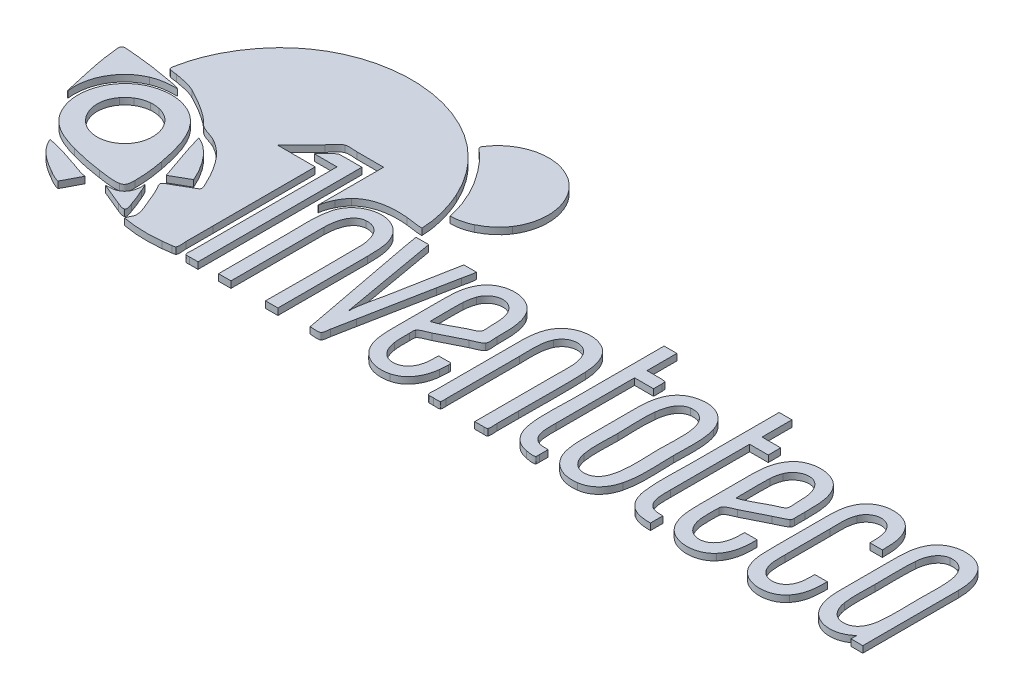
from build123d import *

# Parameters (mm, degrees)
SALIENTE_EXTRUIR1_DEPTH    = 0.3
SALIENTE_EXTRUIR1_2_DEPTH  = 0.3
SALIENTE_EXTRUIR1_3_DEPTH  = 0.3
SALIENTE_EXTRUIR1_4_DEPTH  = 0.3
SALIENTE_EXTRUIR1_5_DEPTH  = 0.3
SALIENTE_EXTRUIR1_6_DEPTH  = 0.3
SALIENTE_EXTRUIR1_7_DEPTH  = 0.3
SALIENTE_EXTRUIR1_8_DEPTH  = 0.3
SALIENTE_EXTRUIR1_9_DEPTH  = 0.3
SALIENTE_EXTRUIR1_10_DEPTH = 0.3
SALIENTE_EXTRUIR1_11_DEPTH = 0.3
SALIENTE_EXTRUIR1_12_DEPTH = 0.3
SALIENTE_EXTRUIR1_13_DEPTH = 0.3
SALIENTE_EXTRUIR1_14_DEPTH = 0.3
SALIENTE_EXTRUIR1_15_DEPTH = 0.3
SALIENTE_EXTRUIR1_16_DEPTH = 0.3
SALIENTE_EXTRUIR1_17_DEPTH = 0.3
SALIENTE_EXTRUIR1_18_DEPTH = 0.3


with BuildPart() as part:
    # Croquis1 → Saliente-Extruir1 (new body)
    with BuildSketch(Plane(origin=(0, 0, 0), x_dir=(1, 0, 0), z_dir=(0, 1, 0))):
        with BuildLine():
            Line((3.578406282, 3.929124777), (1.831381085, 3.929124777))
            add(Edge.make_bspline(
                [(1.831381085, 3.929124777), (2.195955538, 4.293699449), (2.561850832, 4.656953063), (2.925104228, 5.022805122)],
                knots=[0, 0, 0, 0, 1, 1, 1, 1], degree=3))
            add(Edge.make_bspline(
                [(2.925104228, 5.022805122), (3.050477873, 5.149089533), (3.225876383, 5.406839742), (3.393761239, 5.468737315)],
                knots=[0, 0, 0, 0, 1, 1, 1, 1], degree=3))
            add(Edge.make_bspline(
                [(3.393761239, 5.468737315), (3.539659104, 5.52252512), (3.778106582, 5.477296898), (3.933492482, 5.477296898)],
                knots=[0, 0, 0, 0, 1, 1, 1, 1], degree=3))
            Line((3.933492482, 5.477296898), (5.154989666, 5.477296898))
            Line((5.154989666, 5.477296898), (5.154989666, 2.480368276))
            Line((5.154989666, 2.480368276), (5.169193769, 2.480368276))
            add(Edge.make_bspline(
                [(5.169193769, 2.480368276), (5.184873963, 2.677469913), (5.263674964, 2.886373947), (5.350372835, 3.062709863)],
                knots=[0, 0, 0, 0, 1, 1, 1, 1], degree=3))
            add(Edge.make_bspline(
                [(5.350372835, 3.062709863), (5.429102652, 3.222826461), (5.527291326, 3.374887662), (5.652324117, 3.503017188)],
                knots=[0, 0, 0, 0, 1, 1, 1, 1], degree=3))
            add(Edge.make_bspline(
                [(5.652324117, 3.503017188), (6.163520725, 4.026898354), (6.976569044, 4.092033938), (7.66900171, 4.026131922)],
                knots=[0, 0, 0, 0, 1, 1, 1, 1], degree=3))
            add(Edge.make_bspline(
                [(7.66900171, 4.026131922), (7.927561368, 4.001529673), (8.175738383, 3.943324513), (8.435988121, 3.943324513)],
                knots=[0, 0, 0, 0, 1, 1, 1, 1], degree=3))
            add(Edge.make_bspline(
                [(8.435988121, 3.943324513), (8.421102745, 4.664846657), (8.194841973, 5.406920534), (7.900603268, 6.059638484)],
                knots=[0, 0, 0, 0, 1, 1, 1, 1], degree=3))
            add(Edge.make_bspline(
                [(7.900603268, 6.059638484), (7.603907177, 6.717756614), (7.184706429, 7.310922142), (6.674759913, 7.820867784)],
                knots=[0, 0, 0, 0, 1, 1, 1, 1], degree=3))
            add(Edge.make_bspline(
                [(6.674759913, 7.820867784), (4.340535784, 10.155095188), (0.329636401, 10.188178411), (-1.988793551, 7.792404989)],
                knots=[0, 0, 0, 0, 1, 1, 1, 1], degree=3))
            add(Edge.make_bspline(
                [(-1.988793551, 7.792404989), (-2.582355833, 7.179041248), (-3.048016117, 6.446839277), (-3.346856689, 5.647739365)],
                knots=[0, 0, 0, 0, 1, 1, 1, 1], degree=3))
            add(Edge.make_bspline(
                [(-3.346856689, 5.647739365), (-3.449590458, 5.373001005), (-3.543901117, 5.085311909), (-3.59318728, 4.79553314)],
                knots=[0, 0, 0, 0, 1, 1, 1, 1], degree=3))
            add(Edge.make_bspline(
                [(-3.59318728, 4.79553314), (-3.604421732, 4.72948679), (-3.66630664, 4.565535848), (-3.622290079, 4.507599266)],
                knots=[0, 0, 0, 0, 1, 1, 1, 1], degree=3))
            add(Edge.make_bspline(
                [(-3.622290079, 4.507599266), (-3.566200576, 4.433755617), (-3.326460645, 4.433897549), (-3.239251383, 4.417564468)],
                knots=[0, 0, 0, 0, 1, 1, 1, 1], degree=3))
            add(Edge.make_bspline(
                [(-3.239251383, 4.417564468), (-2.921363774, 4.357994578), (-2.57941566, 4.304986306), (-2.28761993, 4.159089096)],
                knots=[0, 0, 0, 0, 1, 1, 1, 1], degree=3))
            add(Edge.make_bspline(
                [(-2.28761993, 4.159089096), (-1.838094895, 3.934334767), (-1.38344219, 3.663913319), (-0.980902058, 3.362474084)],
                knots=[0, 0, 0, 0, 1, 1, 1, 1], degree=3))
            add(Edge.make_bspline(
                [(-0.980902058, 3.362474084), (-0.821809334, 3.243336705), (-0.708252716, 3.076018703), (-0.540594951, 2.969478104)],
                knots=[0, 0, 0, 0, 1, 1, 1, 1], degree=3))
            add(Edge.make_bspline(
                [(-0.540594951, 2.969478104), (-0.333579702, 2.837927147), (-0.07820172, 2.799577161), (0.141170772, 2.689898776)],
                knots=[0, 0, 0, 0, 1, 1, 1, 1], degree=3))
            add(Edge.make_bspline(
                [(0.141170772, 2.689898776), (0.511298691, 2.504826409), (0.835989639, 2.197777591), (1.084322779, 1.869620448)],
                knots=[0, 0, 0, 0, 1, 1, 1, 1], degree=3))
            add(Edge.make_bspline(
                [(1.084322779, 1.869620448), (1.33001424, 1.544943912), (1.540693951, 1.189459429), (1.707897098, 0.81856333)],
                knots=[0, 0, 0, 0, 1, 1, 1, 1], degree=3))
            add(Edge.make_bspline(
                [(1.707897098, 0.81856333), (1.743135938, 0.740374165), (1.885795355, 0.518871167), (1.824251739, 0.44045491)],
                knots=[0, 0, 0, 0, 1, 1, 1, 1], degree=3))
            add(Edge.make_bspline(
                [(1.824251739, 0.44045491), (1.764753469, 0.3646502), (1.629991141, 0.314227271), (1.54731278, 0.266761111)],
                knots=[0, 0, 0, 0, 1, 1, 1, 1], degree=3))
            add(Edge.make_bspline(
                [(1.54731278, 0.266761111), (1.356759223, 0.157364406), (1.168165855, 0.044375734), (0.979174641, -0.06768929)],
                knots=[0, 0, 0, 0, 1, 1, 1, 1], degree=3))
            add(Edge.make_bspline(
                [(0.979174641, -0.06768929), (0.905629267, -0.111292938), (0.712476174, -0.17778015), (0.702647503, -0.275315719)],
                knots=[0, 0, 0, 0, 1, 1, 1, 1], degree=3))
            add(Edge.make_bspline(
                [(0.702647503, -0.275315719), (0.693756018, -0.363531824), (0.792825324, -0.48487264), (0.832751191, -0.559170471)],
                knots=[0, 0, 0, 0, 1, 1, 1, 1], degree=3))
            add(Edge.make_bspline(
                [(0.832751191, -0.559170471), (0.941933251, -0.762395048), (1.029199287, -0.984238683), (1.114831795, -1.198326505)],
                knots=[0, 0, 0, 0, 1, 1, 1, 1], degree=3))
            add(Edge.make_bspline(
                [(1.114831795, -1.198326505), (1.212949285, -1.443619465), (1.394554802, -1.782002251), (1.387396196, -2.050532731)],
                knots=[0, 0, 0, 0, 1, 1, 1, 1], degree=3))
            add(Edge.make_bspline(
                [(1.387396196, -2.050532731), (1.383277989, -2.204755882), (1.259564946, -2.307446852), (1.249039498, -2.448225563)],
                knots=[0, 0, 0, 0, 1, 1, 1, 1], degree=3))
            add(Edge.make_bspline(
                [(1.249039498, -2.448225563), (1.825884173, -2.555320788), (2.428281167, -2.569708311), (3.010267706, -2.507398044)],
                knots=[0, 0, 0, 0, 1, 1, 1, 1], degree=3))
            add(Edge.make_bspline(
                [(3.010267706, -2.507398044), (3.148538372, -2.49259346), (3.284877454, -2.477129439), (3.422167917, -2.454105909)],
                knots=[0, 0, 0, 0, 1, 1, 1, 1], degree=3))
            add(Edge.make_bspline(
                [(3.422167917, -2.454105909), (3.463372044, -2.447184002), (3.535980231, -2.44794825), (3.563804769, -2.411454295)],
                knots=[0, 0, 0, 0, 1, 1, 1, 1], degree=3))
            add(Edge.make_bspline(
                [(3.563804769, -2.411454295), (3.6257744, -2.330182151), (3.578406282, -2.066466219), (3.578406282, -1.965308331)],
                knots=[0, 0, 0, 0, 1, 1, 1, 1], degree=3))
            add(Edge.make_bspline(
                [(3.578406282, -1.965308331), (3.578406282, -1.558223977), (3.582638034, -1.150556611), (3.578463054, -0.74381071)],
                knots=[0, 0, 0, 0, 1, 1, 1, 1], degree=3))
            add(Edge.make_bspline(
                [(3.578463054, -0.74381071), (3.562442224, 0.813455967), (3.578406282, 2.371759839), (3.578406282, 3.929124777)],
                knots=[0, 0, 0, 0, 1, 1, 1, 1], degree=3))
        make_face()
    extrude(amount=SALIENTE_EXTRUIR1_DEPTH)


with BuildPart() as body_2:
    # Croquis1 → Saliente-Extruir1 2 (new body)
    with BuildSketch(Plane(origin=(0, 0, 0), x_dir=(1, 0, 0), z_dir=(0, 1, 0))):
        with BuildLine():
            Line((3.038675476, 4.426241963), (4.075527835, 4.426241963))
            Line((4.075527835, 4.426241963), (4.075527835, -0.829037512))
            Line((4.075527835, -0.829037512), (4.075527835, -2.078940937))
            add(Edge.make_bspline(
                [(4.075527835, -2.078940937), (4.075527835, -2.159346423), (4.032391907, -2.438244478), (4.098295888, -2.490442647)],
                knots=[0, 0, 0, 0, 1, 1, 1, 1], degree=3))
            add(Edge.make_bspline(
                [(4.098295888, -2.490442647), (4.135480505, -2.519901148), (4.215829437, -2.50505071), (4.260172659, -2.50505071)],
                knots=[0, 0, 0, 0, 1, 1, 1, 1], degree=3))
            Line((4.260172659, -2.50505071), (4.657869422, -2.50505071))
            Line((4.657869422, -2.50505071), (4.657869422, 4.980170977))
            Line((4.657869422, 4.980170977), (3.919289689, 4.980170977))
            Line((3.919289689, 4.980170977), (3.592610385, 4.971611394))
            Line((3.592610385, 4.971611394), (3.407965342, 4.809735059))
            Line((3.407965342, 4.809735059), (3.038675476, 4.426241963))
        make_face()
    extrude(amount=SALIENTE_EXTRUIR1_2_DEPTH)


with BuildPart() as body_3:
    # Croquis1 → Saliente-Extruir1 3 (new body)
    with BuildSketch(Plane(origin=(0, 0, 0), x_dir=(1, 0, 0), z_dir=(0, 1, 0))):
        with BuildLine():
            Line((18.63406794, 4.809735059), (18.63406794, 0.733343079))
            add(Edge.make_bspline(
                [(18.63406794, 0.733343079), (18.63406794, 0.008298841), (18.545581291, -0.783842043), (18.690882169, -1.49659935)],
                knots=[0, 0, 0, 0, 1, 1, 1, 1], degree=3))
            add(Edge.make_bspline(
                [(18.690882169, -1.49659935), (18.793005412, -1.996943849), (19.118832688, -2.395706629), (19.642512967, -2.474734066)],
                knots=[0, 0, 0, 0, 1, 1, 1, 1], degree=3))
            add(Edge.make_bspline(
                [(19.642512967, -2.474734066), (19.723756943, -2.486983876), (20.010524574, -2.555111166), (20.068190393, -2.482267372)],
                knots=[0, 0, 0, 0, 1, 1, 1, 1], degree=3))
            add(Edge.make_bspline(
                [(20.068190393, -2.482267372), (20.095744825, -2.44748315), (20.082820292, -2.375925696), (20.082820292, -2.33459514)],
                knots=[0, 0, 0, 0, 1, 1, 1, 1], degree=3))
            Line((20.082820292, -2.33459514), (20.082820292, -1.936897941))
            add(Edge.make_bspline(
                [(20.082820292, -1.936897941), (19.934820307, -1.936897941), (19.784263365, -1.944016369), (19.642512967, -1.893008245)],
                knots=[0, 0, 0, 0, 1, 1, 1, 1], degree=3))
            add(Edge.make_bspline(
                [(19.642512967, -1.893008245), (19.174367347, -1.724498016), (19.216409745, -1.115468873), (19.216409745, -0.71540032)],
                knots=[0, 0, 0, 0, 1, 1, 1, 1], degree=3))
            Line((19.216409745, -0.71540032), (19.216409745, 2.878074209))
            Line((19.216409745, 2.878074209), (20.082820292, 2.878074209))
            Line((20.082820292, 2.878074209), (20.082820292, 3.275771409))
            Line((20.082820292, 3.275771409), (20.068190393, 3.42344364))
            Line((20.068190393, 3.42344364), (19.855565561, 3.446211693))
            Line((19.855565561, 3.446211693), (19.216409745, 3.446211693))
            Line((19.216409745, 3.446211693), (19.216409745, 4.809743794))
            Line((19.216409745, 4.809743794), (18.63406794, 4.809735059))
        make_face()
    extrude(amount=SALIENTE_EXTRUIR1_3_DEPTH)


with BuildPart() as body_4:
    # Croquis1 → Saliente-Extruir1 4 (new body)
    with BuildSketch(Plane(origin=(0, 0, 0), x_dir=(1, 0, 0), z_dir=(0, 1, 0))):
        with BuildLine():
            Line((23.889347415, 4.809743794), (23.889347415, 0.804370145))
            add(Edge.make_bspline(
                [(23.889347415, 0.804370145), (23.889347415, 0.086455253), (23.82088604, -0.67162417), (23.921871645, -1.382962158)],
                knots=[0, 0, 0, 0, 1, 1, 1, 1], degree=3))
            add(Edge.make_bspline(
                [(23.921871645, -1.382962158), (23.977408269, -1.775148035), (24.15892819, -2.172987166), (24.528501047, -2.357745317)],
                knots=[0, 0, 0, 0, 1, 1, 1, 1], degree=3))
            add(Edge.make_bspline(
                [(24.528501047, -2.357745317), (24.773512327, -2.480265041), (25.054172739, -2.505035425), (25.323895446, -2.505035425)],
                knots=[0, 0, 0, 0, 1, 1, 1, 1], degree=3))
            Line((25.323895446, -2.505035425), (25.323895446, -1.936897941))
            add(Edge.make_bspline(
                [(25.323895446, -1.936897941), (25.180439464, -1.936897941), (25.035138586, -1.942444201), (24.897792224, -1.893008245)],
                knots=[0, 0, 0, 0, 1, 1, 1, 1], degree=3))
            add(Edge.make_bspline(
                [(24.897792224, -1.893008245), (24.430356263, -1.724753493), (24.471689002, -1.129629305), (24.471689002, -0.729604423)],
                knots=[0, 0, 0, 0, 1, 1, 1, 1], degree=3))
            Line((24.471689002, -0.729604423), (24.471689002, 2.878074209))
            Line((24.471689002, 2.878074209), (25.323895446, 2.878074209))
            Line((25.323895446, 2.878074209), (25.323895446, 3.446211693))
            Line((25.323895446, 3.446211693), (24.471689002, 3.446211693))
            Line((24.471689002, 3.446211693), (24.471689002, 4.809743794))
            Line((24.471689002, 4.809743794), (23.889347415, 4.809743794))
        make_face()
    extrude(amount=SALIENTE_EXTRUIR1_4_DEPTH)


with BuildPart() as body_5:
    # Croquis1 → Saliente-Extruir1 5 (new body)
    with BuildSketch(Plane(origin=(0, 0, 0), x_dir=(1, 0, 0), z_dir=(0, 1, 0))):
        with BuildLine():
            Line((-5.099902854, 1.301487332), (-5.085700498, 1.301487332))
            add(Edge.make_bspline(
                [(-5.085700498, 1.301487332), (-5.211824417, 2.29946412), (-4.694224936, 3.292242054), (-3.750575948, 3.695806498)],
                knots=[0, 0, 0, 0, 1, 1, 1, 1], degree=3))
            add(Edge.make_bspline(
                [(-3.750575948, 3.695806498), (-3.393032361, 3.848706189), (-3.039678822, 3.872312731), (-2.656910015, 3.872312731)],
                knots=[0, 0, 0, 0, 1, 1, 1, 1], degree=3))
            add(Edge.make_bspline(
                [(-2.656910015, 3.872312731), (-2.840816138, 3.970813437), (-3.106577199, 3.987814689), (-3.310268841, 4.028549131)],
                knots=[0, 0, 0, 0, 1, 1, 1, 1], degree=3))
            add(Edge.make_bspline(
                [(-3.310268841, 4.028549131), (-3.835541159, 4.133585034), (-4.368431941, 4.201845521), (-4.901055892, 4.253390803)],
                knots=[0, 0, 0, 0, 1, 1, 1, 1], degree=3))
            add(Edge.make_bspline(
                [(-4.901055892, 4.253390803), (-5.071193097, 4.269854897), (-5.242778007, 4.274418552), (-5.412380238, 4.29436762)],
                knots=[0, 0, 0, 0, 1, 1, 1, 1], degree=3))
            add(Edge.make_bspline(
                [(-5.412380238, 4.29436762), (-5.478458687, 4.302141119), (-5.569636801, 4.304346521), (-5.608685965, 4.238562199)],
                knots=[0, 0, 0, 0, 1, 1, 1, 1], degree=3))
            add(Edge.make_bspline(
                [(-5.608685965, 4.238562199), (-5.647504108, 4.173168736), (-5.621132297, 4.070648302), (-5.613583706, 4.000143108)],
                knots=[0, 0, 0, 0, 1, 1, 1, 1], degree=3))
            add(Edge.make_bspline(
                [(-5.613583706, 4.000143108), (-5.593783121, 3.815199354), (-5.573445815, 3.630312591), (-5.546194026, 3.446207326)],
                knots=[0, 0, 0, 0, 1, 1, 1, 1], degree=3))
            add(Edge.make_bspline(
                [(-5.546194026, 3.446207326), (-5.438327346, 2.717470676), (-5.248563586, 2.019812734), (-5.099902854, 1.301487332)],
                knots=[0, 0, 0, 0, 1, 1, 1, 1], degree=3))
        make_face()
    extrude(amount=SALIENTE_EXTRUIR1_5_DEPTH)


with BuildPart() as body_6:
    # Croquis1 → Saliente-Extruir1 6 (new body)
    with BuildSketch(Plane(origin=(0, 0, 0), x_dir=(1, 0, 0), z_dir=(0, 1, 0))):
        with BuildLine():
            Line((5.595298301, -2.505039792), (6.16343644, -2.505039792))
            add(Edge.make_bspline(
                [(6.16343644, -2.505039792), (6.16343644, -1.089766107), (6.146662278, 0.326632115), (6.163493212, 1.741792473)],
                knots=[0, 0, 0, 0, 1, 1, 1, 1], degree=3))
            add(Edge.make_bspline(
                [(6.163493212, 1.741792473), (6.16898925, 2.204612155), (6.291054574, 2.919302137), (6.873609058, 2.962012489)],
                knots=[0, 0, 0, 0, 1, 1, 1, 1], degree=3))
            add(Edge.make_bspline(
                [(6.873609058, 2.962012489), (7.500237313, 3.007946003), (7.726938511, 2.380834743), (7.739806707, 1.855420712)],
                knots=[0, 0, 0, 0, 1, 1, 1, 1], degree=3))
            add(Edge.make_bspline(
                [(7.739806707, 1.855420712), (7.775372209, 0.403899816), (7.740019824, -1.053034143), (7.740019824, -2.505039792)],
                knots=[0, 0, 0, 0, 1, 1, 1, 1], degree=3))
            Line((7.740019824, -2.505039792), (8.308157962, -2.505039792))
            Line((8.308157962, -2.505039792), (8.308157962, 1.585556074))
            add(Edge.make_bspline(
                [(8.308157962, 1.585556074), (8.308157962, 2.198775481), (8.285290557, 2.929117271), (7.725816376, 3.317822541)],
                knots=[0, 0, 0, 0, 1, 1, 1, 1], degree=3))
            add(Edge.make_bspline(
                [(7.725816376, 3.317822541), (6.987364599, 3.830866447), (5.919236355, 3.435754591), (5.693074717, 2.579796779)],
                knots=[0, 0, 0, 0, 1, 1, 1, 1], degree=3))
            add(Edge.make_bspline(
                [(5.693074717, 2.579796779), (5.531340096, 1.967656054), (5.595298301, 1.304312867), (5.595298301, 0.676533217)],
                knots=[0, 0, 0, 0, 1, 1, 1, 1], degree=3))
            Line((5.595298301, 0.676533217), (5.595298301, -2.505039792))
        make_face()
    extrude(amount=SALIENTE_EXTRUIR1_6_DEPTH)


with BuildPart() as body_7:
    # Croquis1 → Saliente-Extruir1 7 (new body)
    with BuildSketch(Plane(origin=(0, 0, 0), x_dir=(1, 0, 0), z_dir=(0, 1, 0))):
        with BuildLine():
            Line((12.824857486, 0.026684474), (13.946930752, 0.587804192))
            add(Edge.make_bspline(
                [(13.946930752, 0.587804192), (14.084702691, 0.656719531), (14.333548533, 0.726146042), (14.435529626, 0.841820502)],
                knots=[0, 0, 0, 0, 1, 1, 1, 1], degree=3))
            add(Edge.make_bspline(
                [(14.435529626, 0.841820502), (14.511517756, 0.92800589), (14.458254007, 1.23161974), (14.458254007, 1.344097457)],
                knots=[0, 0, 0, 0, 1, 1, 1, 1], degree=3))
            add(Edge.make_bspline(
                [(14.458254007, 1.344097457), (14.458254007, 1.85390095), (14.475875392, 2.394938402), (14.24136707, 2.863865739)],
                knots=[0, 0, 0, 0, 1, 1, 1, 1], degree=3))
            add(Edge.make_bspline(
                [(14.24136707, 2.863865739), (13.81668535, 3.713218043), (12.481275627, 3.769278941), (11.993244699, 2.949087956)],
                knots=[0, 0, 0, 0, 1, 1, 1, 1], degree=3))
            add(Edge.make_bspline(
                [(11.993244699, 2.949087956), (11.716845518, 2.484464647), (11.731191116, 1.922006403), (11.731191116, 1.400909503)],
                knots=[0, 0, 0, 0, 1, 1, 1, 1], degree=3))
            Line((11.731191116, 1.400909503), (11.731191116, -0.317707488))
            add(Edge.make_bspline(
                [(11.731191116, -0.317707488), (11.731191116, -0.761381873), (11.713720397, -1.207525873), (11.836722689, -1.638629463)],
                knots=[0, 0, 0, 0, 1, 1, 1, 1], degree=3))
            add(Edge.make_bspline(
                [(11.836722689, -1.638629463), (12.044377286, -2.366612783), (12.738927575, -2.726073541), (13.464013302, -2.549099806)],
                knots=[0, 0, 0, 0, 1, 1, 1, 1], degree=3))
            add(Edge.make_bspline(
                [(13.464013302, -2.549099806), (14.070642704, -2.40101488), (14.362950262, -1.832578029), (14.432121078, -1.255136367)],
                knots=[0, 0, 0, 0, 1, 1, 1, 1], degree=3))
            add(Edge.make_bspline(
                [(14.432121078, -1.255136367), (14.44718769, -1.128341001), (14.458254007, -0.999445043), (14.458254007, -0.871643271)],
                knots=[0, 0, 0, 0, 1, 1, 1, 1], degree=3))
            add(Edge.make_bspline(
                [(14.458254007, -0.871643271), (14.458254007, -0.83447241), (14.468909814, -0.770670767), (14.435529626, -0.744208119)],
                knots=[0, 0, 0, 0, 1, 1, 1, 1], degree=3))
            add(Edge.make_bspline(
                [(14.435529626, -0.744208119), (14.398315312, -0.714751801), (14.317925111, -0.729600056), (14.27360962, -0.729600056)],
                knots=[0, 0, 0, 0, 1, 1, 1, 1], degree=3))
            Line((14.27360962, -0.729600056), (13.87591242, -0.729608791))
            add(Edge.make_bspline(
                [(13.87591242, -0.729608791), (13.87591242, -1.065532881), (13.873641511, -1.416089053), (13.683457196, -1.709645393)],
                knots=[0, 0, 0, 0, 1, 1, 1, 1], degree=3))
            add(Edge.make_bspline(
                [(13.683457196, -1.709645393), (13.441712532, -2.082814585), (12.907804426, -2.152679993), (12.598880141, -1.823217078)],
                knots=[0, 0, 0, 0, 1, 1, 1, 1], degree=3))
            add(Edge.make_bspline(
                [(12.598880141, -1.823217078), (12.443637483, -1.657619727), (12.374322333, -1.432210328), (12.338387372, -1.212526241)],
                knots=[0, 0, 0, 0, 1, 1, 1, 1], degree=3))
            add(Edge.make_bspline(
                [(12.338387372, -1.212526241), (12.300181501, -0.978480617), (12.313531829, -0.738755753), (12.313531829, -0.502351876)],
                knots=[0, 0, 0, 0, 1, 1, 1, 1], degree=3))
            add(Edge.make_bspline(
                [(12.313531829, -0.502351876), (12.313531829, -0.431023696), (12.288534355, -0.300110122), (12.328161728, -0.238026946)],
                knots=[0, 0, 0, 0, 1, 1, 1, 1], degree=3))
            add(Edge.make_bspline(
                [(12.328161728, -0.238026946), (12.403724063, -0.119511666), (12.699725998, -0.03591184), (12.824857486, 0.026684474)],
                knots=[0, 0, 0, 0, 1, 1, 1, 1], degree=3))
        make_face()
        with BuildLine():
            add(Edge.make_bspline(
                [(12.313529646, 0.435074601), (12.313529646, 0.940078832), (12.291934168, 1.450367076), (12.314184716, 1.954845067)],
                knots=[0, 0, 0, 0, 1, 1, 1, 1], degree=3))
            add(Edge.make_bspline(
                [(12.314184716, 1.954845067), (12.321718022, 2.127801038), (12.3607733, 2.30332685), (12.417871393, 2.466170723)],
                knots=[0, 0, 0, 0, 1, 1, 1, 1], degree=3))
            add(Edge.make_bspline(
                [(12.417871393, 2.466170723), (12.593851387, 2.967637357), (13.24848891, 3.155605352), (13.617780087, 2.736035362)],
                knots=[0, 0, 0, 0, 1, 1, 1, 1], degree=3))
            add(Edge.make_bspline(
                [(13.617780087, 2.736035362), (13.862363387, 2.458102444), (13.875997579, 2.03466754), (13.875997579, 1.684980428)],
                knots=[0, 0, 0, 0, 1, 1, 1, 1], degree=3))
            add(Edge.make_bspline(
                [(13.875997579, 1.684980428), (13.875997579, 1.573354301), (13.925710848, 1.303332446), (13.861367681, 1.211109495)],
                knots=[0, 0, 0, 0, 1, 1, 1, 1], degree=3))
            add(Edge.make_bspline(
                [(13.861367681, 1.211109495), (13.79219883, 1.111984289), (13.557415378, 1.046306962), (13.449894358, 0.992519376)],
                knots=[0, 0, 0, 0, 1, 1, 1, 1], degree=3))
            add(Edge.make_bspline(
                [(13.449894358, 0.992519376), (13.088699847, 0.81192092), (12.701230475, 0.546742216), (12.313529646, 0.435074601)],
                knots=[0, 0, 0, 0, 1, 1, 1, 1], degree=3))
        make_face(mode=Mode.SUBTRACT)
    extrude(amount=SALIENTE_EXTRUIR1_7_DEPTH)


with BuildPart() as body_8:
    # Croquis1 → Saliente-Extruir1 8 (new body)
    with BuildSketch(Plane(origin=(0, 0, 0), x_dir=(1, 0, 0), z_dir=(0, 1, 0))):
        with BuildLine():
            Line((17.298946448, -2.505031057), (17.725049669, -2.505031057))
            add(Edge.make_bspline(
                [(17.725049669, -2.505031057), (17.768227523, -2.505031057), (17.849329567, -2.519748299), (17.872765572, -2.472107235)],
                knots=[0, 0, 0, 0, 1, 1, 1, 1], degree=3))
            add(Edge.make_bspline(
                [(17.872765572, -2.472107235), (17.91906811, -2.377853785), (17.881281484, -2.183507592), (17.881281484, -2.078927836)],
                knots=[0, 0, 0, 0, 1, 1, 1, 1], degree=3))
            Line((17.881281484, -2.078927836), (17.881281484, -1.098889049))
            add(Edge.make_bspline(
                [(17.881281484, -1.098889049), (17.881281484, -0.073244284), (17.912528327, 0.959377196), (17.86763419, 1.983259824)],
                knots=[0, 0, 0, 0, 1, 1, 1, 1], degree=3))
            add(Edge.make_bspline(
                [(17.86763419, 1.983259824), (17.846038931, 2.477158432), (17.716793603, 3.045125598), (17.270520773, 3.331310216)],
                knots=[0, 0, 0, 0, 1, 1, 1, 1], degree=3))
            add(Edge.make_bspline(
                [(17.270520773, 3.331310216), (16.580090438, 3.774089339), (15.593376269, 3.492946577), (15.3023485, 2.721839993)],
                knots=[0, 0, 0, 0, 1, 1, 1, 1], degree=3))
            add(Edge.make_bspline(
                [(15.3023485, 2.721839993), (15.128355552, 2.261109767), (15.154206801, 1.756686583), (15.154206801, 1.27308786)],
                knots=[0, 0, 0, 0, 1, 1, 1, 1], degree=3))
            Line((15.154206801, 1.27308786), (15.154206801, -0.786412101))
            Line((15.154206801, -0.786412101), (15.154206801, -2.064723732))
            add(Edge.make_bspline(
                [(15.154206801, -2.064723732), (15.154206801, -2.147118448), (15.109749378, -2.43716798), (15.176931182, -2.490429545)],
                knots=[0, 0, 0, 0, 1, 1, 1, 1], degree=3))
            add(Edge.make_bspline(
                [(15.176931182, -2.490429545), (15.227353892, -2.530299294), (15.362713208, -2.505037608), (15.42407144, -2.505037608)],
                knots=[0, 0, 0, 0, 1, 1, 1, 1], degree=3))
            add(Edge.make_bspline(
                [(15.42407144, -2.505037608), (15.49366827, -2.505037608), (15.657293641, -2.535205769), (15.713821823, -2.490429545)],
                knots=[0, 0, 0, 0, 1, 1, 1, 1], degree=3))
            add(Edge.make_bspline(
                [(15.713821823, -2.490429545), (15.762541569, -2.451824081), (15.736548388, -2.305302589), (15.736548388, -2.249368338)],
                knots=[0, 0, 0, 0, 1, 1, 1, 1], degree=3))
            Line((15.736548388, -2.249368338), (15.736548388, -1.524992271))
            Line((15.736548388, -1.524992271), (15.736548388, 1.102647357))
            add(Edge.make_bspline(
                [(15.736548388, 1.102647357), (15.736548388, 1.566063371), (15.671637493, 2.0888069), (15.868783019, 2.522991503)],
                knots=[0, 0, 0, 0, 1, 1, 1, 1], degree=3))
            add(Edge.make_bspline(
                [(15.868783019, 2.522991503), (16.106263177, 3.045907315), (16.803368676, 3.121753513), (17.113288667, 2.622415639)],
                knots=[0, 0, 0, 0, 1, 1, 1, 1], degree=3))
            add(Edge.make_bspline(
                [(17.113288667, 2.622415639), (17.372360152, 2.205118743), (17.298928979, 1.641156239), (17.298928979, 1.173663505)],
                knots=[0, 0, 0, 0, 1, 1, 1, 1], degree=3))
            Line((17.298928979, 1.173663505), (17.298928979, -0.303494652))
            Line((17.298928979, -0.303494652), (17.298946448, -2.505031057))
        make_face()
    extrude(amount=SALIENTE_EXTRUIR1_8_DEPTH)


with BuildPart() as body_9:
    # Croquis1 → Saliente-Extruir1 9 (new body)
    with BuildSketch(Plane(origin=(0, 0, 0), x_dir=(1, 0, 0), z_dir=(0, 1, 0))):
        with BuildLine():
            Line((20.452096184, 1.244681837), (20.452096184, -0.331902857))
            add(Edge.make_bspline(
                [(20.452096184, -0.331902857), (20.452096184, -0.752311336), (20.43860174, -1.171141097), (20.542569879, -1.5818065)],
                knots=[0, 0, 0, 0, 1, 1, 1, 1], degree=3))
            add(Edge.make_bspline(
                [(20.542569879, -1.5818065), (20.726646757, -2.30814341), (21.344355578, -2.675102537), (22.071288602, -2.571985771)],
                knots=[0, 0, 0, 0, 1, 1, 1, 1], degree=3))
            add(Edge.make_bspline(
                [(22.071288602, -2.571985771), (22.63204148, -2.492460262), (22.974201838, -2.048517298), (23.102885989, -1.524992271)],
                knots=[0, 0, 0, 0, 1, 1, 1, 1], degree=3))
            add(Edge.make_bspline(
                [(23.102885989, -1.524992271), (23.27588323, -0.820316346), (23.179157983, -0.01610252), (23.179157983, 0.704950158)],
                knots=[0, 0, 0, 0, 1, 1, 1, 1], degree=3))
            add(Edge.make_bspline(
                [(23.179157983, 0.704950158), (23.179157983, 1.338538096), (23.257135125, 2.040159211), (23.056013541, 2.650823845)],
                knots=[0, 0, 0, 0, 1, 1, 1, 1], degree=3))
            add(Edge.make_bspline(
                [(23.056013541, 2.650823845), (22.860147584, 3.245266978), (22.301242222, 3.608832842), (21.673591402, 3.525416217)],
                knots=[0, 0, 0, 0, 1, 1, 1, 1], degree=3))
            add(Edge.make_bspline(
                [(21.673591402, 3.525416217), (21.175618476, 3.459212651), (20.793263018, 3.220153775), (20.605633476, 2.736044096)],
                knots=[0, 0, 0, 0, 1, 1, 1, 1], degree=3))
            add(Edge.make_bspline(
                [(20.605633476, 2.736044096), (20.422410591, 2.262898108), (20.452096184, 1.742440992), (20.452096184, 1.244681837)],
                knots=[0, 0, 0, 0, 1, 1, 1, 1], degree=3))
        make_face()
        with BuildLine():
            add(Edge.make_bspline(
                [(21.702102236, 2.959184769), (22.193542149, 3.023187301), (22.478178618, 2.654577397), (22.561979551, 2.210507786)],
                knots=[0, 0, 0, 0, 1, 1, 1, 1], degree=3))
            add(Edge.make_bspline(
                [(22.561979551, 2.210507786), (22.659840471, 1.691328057), (22.596918806, 1.118290431), (22.596918806, 0.591313184)],
                knots=[0, 0, 0, 0, 1, 1, 1, 1], degree=3))
            add(Edge.make_bspline(
                [(22.596918806, 0.591313184), (22.596918806, 0.055503191), (22.660833994, -0.525419077), (22.590957668, -1.056287658)],
                knots=[0, 0, 0, 0, 1, 1, 1, 1], degree=3))
            add(Edge.make_bspline(
                [(22.590957668, -1.056287658), (22.535706873, -1.475899135), (22.411143331, -1.967764843), (21.915157232, -2.032221338)],
                knots=[0, 0, 0, 0, 1, 1, 1, 1], degree=3))
            add(Edge.make_bspline(
                [(21.915157232, -2.032221338), (21.432239781, -2.094972686), (21.150869928, -1.71544058), (21.06948402, -1.283542171)],
                knots=[0, 0, 0, 0, 1, 1, 1, 1], degree=3))
            add(Edge.make_bspline(
                [(21.06948402, -1.283542171), (20.974035941, -0.777559921), (21.034542582, -0.220484169), (21.034542582, 0.293040121)],
                knots=[0, 0, 0, 0, 1, 1, 1, 1], degree=3))
            add(Edge.make_bspline(
                [(21.034542582, 0.293040121), (21.034542582, 0.849362542), (20.97318435, 1.44532522), (21.038669523, 1.997455192)],
                knots=[0, 0, 0, 0, 1, 1, 1, 1], degree=3))
            add(Edge.make_bspline(
                [(21.038669523, 1.997455192), (21.086819358, 2.404428184), (21.22416572, 2.896918392), (21.702102236, 2.959184769)],
                knots=[0, 0, 0, 0, 1, 1, 1, 1], degree=3))
        make_face(mode=Mode.SUBTRACT)
    extrude(amount=SALIENTE_EXTRUIR1_9_DEPTH)


with BuildPart() as body_10:
    # Croquis1 → Saliente-Extruir1 10 (new body)
    with BuildSketch(Plane(origin=(0, 0, 0), x_dir=(1, 0, 0), z_dir=(0, 1, 0))):
        with BuildLine():
            Line((28.420233137, -0.729600056), (27.852095435, -0.729600056))
            add(Edge.make_bspline(
                [(27.852095435, -0.729600056), (27.852095435, -1.064928033), (27.846702025, -1.417615366), (27.657507084, -1.709636659)],
                knots=[0, 0, 0, 0, 1, 1, 1, 1], degree=3))
            add(Edge.make_bspline(
                [(27.657507084, -1.709636659), (27.395027268, -2.115033115), (26.823197155, -2.146352016), (26.524356582, -1.766450888)],
                knots=[0, 0, 0, 0, 1, 1, 1, 1], degree=3))
            add(Edge.make_bspline(
                [(26.524356582, -1.766450888), (26.218412867, -1.377546912), (26.28659016, -0.793698664), (26.289714844, -0.331902857)],
                knots=[0, 0, 0, 0, 1, 1, 1, 1], degree=3))
            add(Edge.make_bspline(
                [(26.289714844, -0.331902857), (26.291024984, -0.143052701), (26.637414911, -0.055007133), (26.786836398, 0.019675225)],
                knots=[0, 0, 0, 0, 1, 1, 1, 1], degree=3))
            Line((26.786836398, 0.019675225), (27.837891332, 0.545202801))
            add(Edge.make_bspline(
                [(27.837891332, 0.545202801), (28.013445748, 0.633008395), (28.211726512, 0.707563887), (28.37549185, 0.815678838)],
                knots=[0, 0, 0, 0, 1, 1, 1, 1], degree=3))
            add(Edge.make_bspline(
                [(28.37549185, 0.815678838), (28.43443724, 0.854596552), (28.420233137, 0.926750339), (28.420233137, 0.989019118)],
                knots=[0, 0, 0, 0, 1, 1, 1, 1], degree=3))
            Line((28.420233137, 0.989019118), (28.420233137, 1.457732247))
            add(Edge.make_bspline(
                [(28.420233137, 1.457732247), (28.420233137, 2.103777435), (28.433159853, 2.894269726), (27.837891332, 3.312136533)],
                knots=[0, 0, 0, 0, 1, 1, 1, 1], degree=3))
            add(Edge.make_bspline(
                [(27.837891332, 3.312136533), (27.405538741, 3.615649939), (26.700336576, 3.615280916), (26.275510741, 3.2968734)],
                knots=[0, 0, 0, 0, 1, 1, 1, 1], degree=3))
            add(Edge.make_bspline(
                [(26.275510741, 3.2968734), (26.063453854, 3.13789444), (25.926533288, 2.911760097), (25.838328319, 2.66501703)],
                knots=[0, 0, 0, 0, 1, 1, 1, 1], degree=3))
            add(Edge.make_bspline(
                [(25.838328319, 2.66501703), (25.682091919, 2.227893346), (25.707373257, 1.757843874), (25.707373257, 1.301487332)],
                knots=[0, 0, 0, 0, 1, 1, 1, 1], degree=3))
            Line((25.707373257, 1.301487332), (25.707373257, -0.644386356))
            add(Edge.make_bspline(
                [(25.707373257, -0.644386356), (25.707373257, -1.133994255), (25.726828839, -1.65746251), (26.010760016, -2.07893657)],
                knots=[0, 0, 0, 0, 1, 1, 1, 1], degree=3))
            add(Edge.make_bspline(
                [(26.010760016, -2.07893657), (26.442544879, -2.71989623), (27.526126227, -2.77463607), (28.032621834, -2.192562844)],
                knots=[0, 0, 0, 0, 1, 1, 1, 1], degree=3))
            add(Edge.make_bspline(
                [(28.032621834, -2.192562844), (28.385719678, -1.786786447), (28.430742645, -1.240733559), (28.420233137, -0.729600056)],
                knots=[0, 0, 0, 0, 1, 1, 1, 1], degree=3))
        make_face()
        with BuildLine():
            add(Edge.make_bspline(
                [(26.289828389, 0.435074601), (26.289828389, 0.949524942), (26.267955599, 1.469342273), (26.29048346, 1.983251089)],
                knots=[0, 0, 0, 0, 1, 1, 1, 1], degree=3))
            add(Edge.make_bspline(
                [(26.29048346, 1.983251089), (26.297732902, 2.147870202), (26.33394736, 2.327686723), (26.395731387, 2.480372643)],
                knots=[0, 0, 0, 0, 1, 1, 1, 1], degree=3))
            add(Edge.make_bspline(
                [(26.395731387, 2.480372643), (26.584780247, 2.947026669), (27.20973196, 3.166158531), (27.579872544, 2.750182693)],
                knots=[0, 0, 0, 0, 1, 1, 1, 1], degree=3))
            add(Edge.make_bspline(
                [(27.579872544, 2.750182693), (27.827724644, 2.471553216), (27.852296323, 2.052535669), (27.852296323, 1.699182347)],
                knots=[0, 0, 0, 0, 1, 1, 1, 1], degree=3))
            add(Edge.make_bspline(
                [(27.852296323, 1.699182347), (27.852296323, 1.584689197), (27.903712774, 1.305590254), (27.837666425, 1.211109495)],
                knots=[0, 0, 0, 0, 1, 1, 1, 1], degree=3))
            add(Edge.make_bspline(
                [(27.837666425, 1.211109495), (27.768495609, 1.111969004), (27.533711938, 1.046306962), (27.426193101, 0.992519376)],
                knots=[0, 0, 0, 0, 1, 1, 1, 1], degree=3))
            add(Edge.make_bspline(
                [(27.426193101, 0.992519376), (27.064998591, 0.81192092), (26.677527036, 0.546742216), (26.289828389, 0.435074601)],
                knots=[0, 0, 0, 0, 1, 1, 1, 1], degree=3))
        make_face(mode=Mode.SUBTRACT)
    extrude(amount=SALIENTE_EXTRUIR1_10_DEPTH)


with BuildPart() as body_11:
    # Croquis1 → Saliente-Extruir1 11 (new body)
    with BuildSketch(Plane(origin=(0, 0, 0), x_dir=(1, 0, 0), z_dir=(0, 1, 0))):
        with BuildLine():
            Line((31.687028581, -0.786420836), (31.118888914, -0.786420836))
            add(Edge.make_bspline(
                [(31.118888914, -0.786420836), (31.118888914, -1.098812625), (31.124719038, -1.452834118), (30.943334497, -1.723849496)],
                knots=[0, 0, 0, 0, 1, 1, 1, 1], degree=3))
            add(Edge.make_bspline(
                [(30.943334497, -1.723849496), (30.672190288, -2.129031963), (30.084166842, -2.117526749), (29.822115006, -1.709634475)],
                knots=[0, 0, 0, 0, 1, 1, 1, 1], degree=3))
            add(Edge.make_bspline(
                [(29.822115006, -1.709634475), (29.634911478, -1.418335943), (29.655932677, -1.01848138), (29.655932677, -0.686987747)],
                knots=[0, 0, 0, 0, 1, 1, 1, 1], degree=3))
            Line((29.655932677, -0.686987747), (29.655932677, 1.358310295))
            add(Edge.make_bspline(
                [(29.655932677, 1.358310295), (29.655932677, 1.729673676), (29.609914003, 2.157014981), (29.753369767, 2.508791767)],
                knots=[0, 0, 0, 0, 1, 1, 1, 1], degree=3))
            add(Edge.make_bspline(
                [(29.753369767, 2.508791767), (29.948665813, 2.987219586), (30.575890618, 3.142562906), (30.91251345, 2.707640257)],
                knots=[0, 0, 0, 0, 1, 1, 1, 1], degree=3))
            add(Edge.make_bspline(
                [(30.91251345, 2.707640257), (31.123860896, 2.434635649), (31.118888914, 2.05494851), (31.118888914, 1.727601471)],
                knots=[0, 0, 0, 0, 1, 1, 1, 1], degree=3))
            Line((31.118888914, 1.727601471), (31.687028581, 1.727601471))
            add(Edge.make_bspline(
                [(31.687028581, 1.727601471), (31.687028581, 2.224465146), (31.662882698, 2.7337448), (31.325692139, 3.133743479)],
                knots=[0, 0, 0, 0, 1, 1, 1, 1], degree=3))
            add(Edge.make_bspline(
                [(31.325692139, 3.133743479), (30.839082276, 3.711071596), (29.791575638, 3.656146371), (29.368313237, 3.034319125)],
                knots=[0, 0, 0, 0, 1, 1, 1, 1], degree=3))
            add(Edge.make_bspline(
                [(29.368313237, 3.034319125), (29.099584053, 2.639576292), (29.087794975, 2.158248696), (29.087794975, 1.699193265)],
                knots=[0, 0, 0, 0, 1, 1, 1, 1], degree=3))
            Line((29.087794975, 1.699193265), (29.087794975, -0.587563393))
            add(Edge.make_bspline(
                [(29.087794975, -0.587563393), (29.087794975, -1.091530429), (29.067203939, -1.621191497), (29.349707063, -2.064721549)],
                knots=[0, 0, 0, 0, 1, 1, 1, 1], degree=3))
            add(Edge.make_bspline(
                [(29.349707063, -2.064721549), (29.767145891, -2.720311108), (30.846325168, -2.779824225), (31.339610195, -2.178350006)],
                knots=[0, 0, 0, 0, 1, 1, 1, 1], degree=3))
            add(Edge.make_bspline(
                [(31.339610195, -2.178350006), (31.665721335, -1.780510875), (31.687028581, -1.275122337), (31.687028581, -0.786420836)],
                knots=[0, 0, 0, 0, 1, 1, 1, 1], degree=3))
        make_face()
    extrude(amount=SALIENTE_EXTRUIR1_11_DEPTH)


with BuildPart() as body_12:
    # Croquis1 → Saliente-Extruir1 12 (new body)
    with BuildSketch(Plane(origin=(0, 0, 0), x_dir=(1, 0, 0), z_dir=(0, 1, 0))):
        with BuildLine():
            Line((34.485108712, -2.235164235), (34.485108712, -2.505028874))
            Line((34.485108712, -2.505028874), (35.024840392, -2.505028874))
            Line((35.024840392, -2.505028874), (35.024840392, 0.065796526))
            Line((35.024840392, 0.065796526), (35.024840392, 1.869635733))
            add(Edge.make_bspline(
                [(35.024840392, 1.869635733), (35.024840392, 2.329472881), (34.925699901, 2.867427137), (34.582118042, 3.200698193)],
                knots=[0, 0, 0, 0, 1, 1, 1, 1], degree=3))
            add(Edge.make_bspline(
                [(34.582118042, 3.200698193), (34.039971337, 3.726467927), (32.973434913, 3.629314701), (32.576305441, 2.977504896)],
                knots=[0, 0, 0, 0, 1, 1, 1, 1], degree=3))
            add(Edge.make_bspline(
                [(32.576305441, 2.977504896), (32.308713896, 2.538162926), (32.311980512, 2.025048928), (32.311980512, 1.528752763)],
                knots=[0, 0, 0, 0, 1, 1, 1, 1], degree=3))
            Line((32.311980512, 1.528752763), (32.311980512, -0.402916822))
            add(Edge.make_bspline(
                [(32.311980512, -0.402916822), (32.311980512, -0.850525995), (32.284851876, -1.309622695), (32.44052033, -1.738042681)],
                knots=[0, 0, 0, 0, 1, 1, 1, 1], degree=3))
            add(Edge.make_bspline(
                [(32.44052033, -1.738042681), (32.528723333, -1.980567097), (32.670048154, -2.209013837), (32.880117995, -2.364073294)],
                knots=[0, 0, 0, 0, 1, 1, 1, 1], degree=3))
            add(Edge.make_bspline(
                [(32.880117995, -2.364073294), (33.361755876, -2.719487903), (34.070508521, -2.64949148), (34.485108712, -2.235164235)],
                knots=[0, 0, 0, 0, 1, 1, 1, 1], degree=3))
        make_face()
        with BuildLine():
            add(Edge.make_bspline(
                [(33.547880722, 2.959184769), (34.062189131, 3.026170053), (34.347677191, 2.631639026), (34.422246003, 2.167897879)],
                knots=[0, 0, 0, 0, 1, 1, 1, 1], degree=3))
            add(Edge.make_bspline(
                [(34.422246003, 2.167897879), (34.500365295, 1.682395085), (34.456901394, 1.167206698), (34.456901394, 0.676533217)],
                knots=[0, 0, 0, 0, 1, 1, 1, 1], degree=3))
            add(Edge.make_bspline(
                [(34.456901394, 0.676533217), (34.456901394, 0.08926332), (34.49596104, -0.514424817), (34.44028445, -1.098897784)],
                knots=[0, 0, 0, 0, 1, 1, 1, 1], degree=3))
            add(Edge.make_bspline(
                [(34.44028445, -1.098897784), (34.401366736, -1.507274809), (34.240300504, -1.971756404), (33.775135453, -2.032221338)],
                knots=[0, 0, 0, 0, 1, 1, 1, 1], degree=3))
            add(Edge.make_bspline(
                [(33.775135453, -2.032221338), (33.26182275, -2.098920575), (32.976760486, -1.686962499), (32.910572204, -1.226728161)],
                knots=[0, 0, 0, 0, 1, 1, 1, 1], degree=3))
            add(Edge.make_bspline(
                [(32.910572204, -1.226728161), (32.843106535, -0.757346642), (32.880318884, -0.265793184), (32.880318884, 0.207820088)],
                knots=[0, 0, 0, 0, 1, 1, 1, 1], degree=3))
            add(Edge.make_bspline(
                [(32.880318884, 0.207820088), (32.880318884, 0.816523879), (32.853048316, 1.433265379), (32.895800373, 2.040065318)],
                knots=[0, 0, 0, 0, 1, 1, 1, 1], degree=3))
            add(Edge.make_bspline(
                [(32.895800373, 2.040065318), (32.923354805, 2.431157227), (33.108995117, 2.902001736), (33.547880722, 2.959184769)],
                knots=[0, 0, 0, 0, 1, 1, 1, 1], degree=3))
        make_face(mode=Mode.SUBTRACT)
    extrude(amount=SALIENTE_EXTRUIR1_12_DEPTH)


with BuildPart() as body_13:
    # Croquis1 → Saliente-Extruir1 13 (new body)
    with BuildSketch(Plane(origin=(0, 0, 0), x_dir=(1, 0, 0), z_dir=(0, 1, 0))):
        with BuildLine():
            Line((8.663242852, 3.446207326), (8.770904713, 2.821255614))
            Line((8.770904713, 2.821255614), (9.049576769, 1.358299377))
            Line((9.049576769, 1.358299377), (9.785315682, -2.505039792))
            add(Edge.make_bspline(
                [(9.785315682, -2.505039792), (9.892409597, -2.505039792), (10.174348269, -2.555689811), (10.259852821, -2.490431729)],
                knots=[0, 0, 0, 0, 1, 1, 1, 1], degree=3))
            add(Edge.make_bspline(
                [(10.259852821, -2.490431729), (10.326609267, -2.439554619), (10.331722307, -2.215780711), (10.347772398, -2.135744248)],
                knots=[0, 0, 0, 0, 1, 1, 1, 1], degree=3))
            add(Edge.make_bspline(
                [(10.347772398, -2.135744248), (10.413818529, -1.804746285), (10.47702384, -1.472953504), (10.540939465, -1.141501359)],
                knots=[0, 0, 0, 0, 1, 1, 1, 1], degree=3))
            Line((10.540939465, -1.141501359), (11.131803077, 1.912241492))
            add(Edge.make_bspline(
                [(11.131803077, 1.912241492), (11.19401421, 2.234247526), (11.255941261, 2.556338938), (11.319288722, 2.878076393)],
                knots=[0, 0, 0, 0, 1, 1, 1, 1], degree=3))
            add(Edge.make_bspline(
                [(11.319288722, 2.878076393), (11.355791629, 3.063487212), (11.414735709, 3.256741623), (11.418712858, 3.446213877)],
                knots=[0, 0, 0, 0, 1, 1, 1, 1], degree=3))
            Line((11.418712858, 3.446213877), (10.850574719, 3.446213877))
            add(Edge.make_bspline(
                [(10.850574719, 3.446213877), (10.657975816, 2.453379388), (10.470206089, 1.458754157), (10.290674305, 0.463489358)],
                knots=[0, 0, 0, 0, 1, 1, 1, 1], degree=3))
            add(Edge.make_bspline(
                [(10.290674305, 0.463489358), (10.206163931, -0.004898638), (10.042256006, -0.508354501), (10.040977746, -0.985262776)],
                knots=[0, 0, 0, 0, 1, 1, 1, 1], degree=3))
            Line((10.040977746, -0.985262776), (10.026773643, -0.985262776))
            Line((10.026773643, -0.985262776), (9.245584221, 3.446207326))
            Line((9.245584221, 3.446207326), (8.663242852, 3.446207326))
        make_face()
    extrude(amount=SALIENTE_EXTRUIR1_13_DEPTH)


with BuildPart() as body_14:
    # Croquis1 → Saliente-Extruir1 14 (new body)
    with BuildSketch(Plane(origin=(0, 0, 0), x_dir=(1, 0, 0), z_dir=(0, 1, 0))):
        with BuildLine():
            Line((-0.227934584, 2.409356495), (-0.00540924, 1.684980428))
            Line((-0.00540924, 1.684980428), (0.510644931, 0.193615985))
            Line((0.510644931, 0.193615985), (1.306038457, 0.648127413))
            add(Edge.make_bspline(
                [(1.306038457, 0.648127413), (1.09710538, 1.14996307), (0.773423022, 1.66334783), (0.368610233, 2.028263139)],
                knots=[0, 0, 0, 0, 1, 1, 1, 1], degree=3))
            add(Edge.make_bspline(
                [(0.368610233, 2.028263139), (0.19622308, 2.183663014), (-0.000338561, 2.3438211), (-0.227934584, 2.409356495)],
                knots=[0, 0, 0, 0, 1, 1, 1, 1], degree=3))
        make_face()
    extrude(amount=SALIENTE_EXTRUIR1_14_DEPTH)


with BuildPart() as body_15:
    # Croquis1 → Saliente-Extruir1 15 (new body)
    with BuildSketch(Plane(origin=(0, 0, 0), x_dir=(1, 0, 0), z_dir=(0, 1, 0))):
        with BuildLine():
            Line((-0.469393636, -1.581815234), (-0.469393636, -1.596030255))
            add(Edge.make_bspline(
                [(-0.469393636, -1.596030255), (-0.137046666, -1.734400492), (0.185584742, -1.884302364), (0.524848379, -2.007162942)],
                knots=[0, 0, 0, 0, 1, 1, 1, 1], degree=3))
            add(Edge.make_bspline(
                [(0.524848379, -2.007162942), (0.605097959, -2.036223816), (0.809797972, -2.13507826), (0.889621538, -2.088079165)],
                knots=[0, 0, 0, 0, 1, 1, 1, 1], degree=3))
            add(Edge.make_bspline(
                [(0.889621538, -2.088079165), (0.984642729, -2.032103426), (0.866441446, -1.797007724), (0.84205406, -1.723860414)],
                knots=[0, 0, 0, 0, 1, 1, 1, 1], degree=3))
            add(Edge.make_bspline(
                [(0.84205406, -1.723860414), (0.755143073, -1.463142737), (0.652580059, -1.205689493), (0.535927143, -0.956874221)],
                knots=[0, 0, 0, 0, 1, 1, 1, 1], degree=3))
            add(Edge.make_bspline(
                [(0.535927143, -0.956874221), (0.48952438, -0.857875881), (0.453049859, -0.743382731), (0.382813681, -0.658590459)],
                knots=[0, 0, 0, 0, 1, 1, 1, 1], degree=3))
            add(Edge.make_bspline(
                [(0.382813681, -0.658590459), (0.427824638, -1.014699442), (0.332547751, -1.403079361), (-0.043289978, -1.537927722)],
                knots=[0, 0, 0, 0, 1, 1, 1, 1], degree=3))
            add(Edge.make_bspline(
                [(-0.043289978, -1.537927722), (-0.181929666, -1.587667194), (-0.324660268, -1.581815234), (-0.469393636, -1.581815234)],
                knots=[0, 0, 0, 0, 1, 1, 1, 1], degree=3))
        make_face()
    extrude(amount=SALIENTE_EXTRUIR1_15_DEPTH)


with BuildPart() as body_16:
    # Croquis1 → Saliente-Extruir1 16 (new body)
    with BuildSketch(Plane(origin=(0, 0, 0), x_dir=(1, 0, 0), z_dir=(0, 1, 0))):
        with BuildLine():
            Line((-1.733500946, -2.50505071), (-1.307397287, -1.695454391))
            add(Edge.make_bspline(
                [(-1.307397287, -1.695454391), (-1.528076425, -1.685846697), (-1.765373381, -1.568460539), (-1.97495978, -1.50149054)],
                knots=[0, 0, 0, 0, 1, 1, 1, 1], degree=3))
            add(Edge.make_bspline(
                [(-1.97495978, -1.50149054), (-2.484820919, -1.338592078), (-3.035787269, -1.120071833), (-3.565746394, -1.042094473)],
                knots=[0, 0, 0, 0, 1, 1, 1, 1], degree=3))
            add(Edge.make_bspline(
                [(-3.565746394, -1.042094473), (-3.336346526, -1.593088991), (-2.817948733, -1.957550117), (-2.315842533, -2.241208348)],
                knots=[0, 0, 0, 0, 1, 1, 1, 1], degree=3))
            add(Edge.make_bspline(
                [(-2.315842533, -2.241208348), (-2.143696664, -2.33845787), (-1.930943219, -2.475450276), (-1.733500946, -2.50505071)],
                knots=[0, 0, 0, 0, 1, 1, 1, 1], degree=3))
        make_face()
    extrude(amount=SALIENTE_EXTRUIR1_16_DEPTH)


with BuildPart() as body_17:
    # Croquis1 → Saliente-Extruir1 17 (new body)
    with BuildSketch(Plane(origin=(0, 0, 0), x_dir=(1, 0, 0), z_dir=(0, 1, 0))):
        with BuildLine():
            add(Edge.make_bspline(
                [(8.606428842, 5.065402146), (8.907684221, 5.06560085), (9.230954759, 5.142099935), (9.501246285, 5.274987235)],
                knots=[0, 0, 0, 0, 1, 1, 1, 1], degree=3))
            add(Edge.make_bspline(
                [(9.501246285, 5.274987235), (9.876501656, 5.459505194), (10.205737918, 5.721174906), (10.43753818, 6.073846954)],
                knots=[0, 0, 0, 0, 1, 1, 1, 1], degree=3))
            add(Edge.make_bspline(
                [(10.43753818, 6.073846954), (11.145580293, 7.151165832), (10.818190893, 8.668451398), (9.685891327, 9.31621287)],
                knots=[0, 0, 0, 0, 1, 1, 1, 1], degree=3))
            add(Edge.make_bspline(
                [(9.685891327, 9.31621287), (9.450398216, 9.450940916), (9.188202265, 9.550819453), (8.918904917, 9.592403302)],
                knots=[0, 0, 0, 0, 1, 1, 1, 1], degree=3))
            add(Edge.make_bspline(
                [(8.918904917, 9.592403302), (8.213206208, 9.70139823), (7.518770993, 9.493240975), (6.987249307, 9.016319818)],
                knots=[0, 0, 0, 0, 1, 1, 1, 1], degree=3))
            add(Edge.make_bspline(
                [(6.987249307, 9.016319818), (6.856889923, 8.899357054), (6.737794032, 8.763333934), (6.642020165, 8.61626655)],
                knots=[0, 0, 0, 0, 1, 1, 1, 1], degree=3))
            add(Edge.make_bspline(
                [(6.642020165, 8.61626655), (6.615317543, 8.575248245), (6.551089449, 8.500891239), (6.567110935, 8.448234522)],
                knots=[0, 0, 0, 0, 1, 1, 1, 1], degree=3))
            add(Edge.make_bspline(
                [(6.567110935, 8.448234522), (6.598202308, 8.34612438), (6.784423886, 8.236618715), (6.859403863, 8.161755122)],
                knots=[0, 0, 0, 0, 1, 1, 1, 1], degree=3))
            add(Edge.make_bspline(
                [(6.859403863, 8.161755122), (7.082085769, 7.939428701), (7.285678059, 7.70025628), (7.478319542, 7.451583158)],
                knots=[0, 0, 0, 0, 1, 1, 1, 1], degree=3))
            add(Edge.make_bspline(
                [(7.478319542, 7.451583158), (8.009230266, 6.766251234), (8.430533134, 5.917551817), (8.606428842, 5.065402146)],
                knots=[0, 0, 0, 0, 1, 1, 1, 1], degree=3))
        make_face()
    extrude(amount=SALIENTE_EXTRUIR1_17_DEPTH)


with BuildPart() as body_18:
    # Croquis1 → Saliente-Extruir1 18 (new body)
    with BuildSketch(Plane(origin=(0, 0, 0), x_dir=(1, 0, 0), z_dir=(0, 1, 0))):
        with BuildLine():
            add(Edge.make_bspline(
                [(-2.79894515, 3.482795174), (-3.148577236, 3.436322318), (-3.487315726, 3.327552297), (-3.778983499, 3.123491632)],
                knots=[0, 0, 0, 0, 1, 1, 1, 1], degree=3))
            add(Edge.make_bspline(
                [(-3.778983499, 3.123491632), (-4.766701672, 2.432421513), (-4.984004578, 1.020272512), (-4.249298275, 0.065785608)],
                knots=[0, 0, 0, 0, 1, 1, 1, 1], degree=3))
            add(Edge.make_bspline(
                [(-4.249298275, 0.065785608), (-3.855909471, -0.445269286), (-3.257617365, -0.668078057), (-2.65691067, -0.835055423)],
                knots=[0, 0, 0, 0, 1, 1, 1, 1], degree=3))
            add(Edge.make_bspline(
                [(-2.65691067, -0.835055423), (-2.185952397, -0.965966594), (-1.708134012, -1.07138484), (-1.222361766, -1.129507025)],
                knots=[0, 0, 0, 0, 1, 1, 1, 1], degree=3))
            add(Edge.make_bspline(
                [(-1.222361766, -1.129507025), (-0.920907464, -1.165583919), (-0.543095572, -1.246386814), (-0.242323416, -1.193649305)],
                knots=[0, 0, 0, 0, 1, 1, 1, 1], degree=3))
            add(Edge.make_bspline(
                [(-0.242323416, -1.193649305), (0.001876668, -1.15082519), (-0.000864582, -0.926395994), (-0.000864582, -0.729608791)],
                knots=[0, 0, 0, 0, 1, 1, 1, 1], degree=3))
            add(Edge.make_bspline(
                [(-0.000864582, -0.729608791), (-0.000864582, -0.279615163), (-0.054440144, 0.177112586), (-0.137373982, 0.619721391)],
                knots=[0, 0, 0, 0, 1, 1, 1, 1], degree=3))
            add(Edge.make_bspline(
                [(-0.137373982, 0.619721391), (-0.32765765, 1.635225671), (-0.623430311, 2.796939412), (-1.634261758, 3.286304936)],
                knots=[0, 0, 0, 0, 1, 1, 1, 1], degree=3))
            add(Edge.make_bspline(
                [(-1.634261758, 3.286304936), (-1.800854161, 3.36695258), (-1.978610486, 3.421622546), (-2.159789771, 3.457570608)],
                knots=[0, 0, 0, 0, 1, 1, 1, 1], degree=3))
            add(Edge.make_bspline(
                [(-2.159789771, 3.457570608), (-2.361620796, 3.497623777), (-2.594372875, 3.509980583), (-2.79894515, 3.482795174)],
                knots=[0, 0, 0, 0, 1, 1, 1, 1], degree=3))
        make_face()
        with BuildLine():
            add(Edge.make_bspline(
                [(-2.727742743, 2.703581006), (-2.581447032, 2.721071378), (-2.430038281, 2.703666166), (-2.287435637, 2.66993224)],
                knots=[0, 0, 0, 0, 1, 1, 1, 1], degree=3))
            add(Edge.make_bspline(
                [(-2.287435637, 2.66993224), (-1.193499814, 2.411144836), (-0.973090565, 0.885524595), (-1.932349436, 0.313679196)],
                knots=[0, 0, 0, 0, 1, 1, 1, 1], degree=3))
            add(Edge.make_bspline(
                [(-1.932349436, 0.313679196), (-2.084425486, 0.223017714), (-2.253617207, 0.162482687), (-2.429470117, 0.140865374)],
                knots=[0, 0, 0, 0, 1, 1, 1, 1], degree=3))
            add(Edge.make_bspline(
                [(-2.429470117, 0.140865374), (-3.533490306, 0.00520691), (-4.32352776, 1.293630858), (-3.63341164, 2.196303683)],
                knots=[0, 0, 0, 0, 1, 1, 1, 1], degree=3))
            add(Edge.make_bspline(
                [(-3.63341164, 2.196303683), (-3.536757141, 2.322727843), (-3.418158448, 2.434054821), (-3.281677434, 2.516591468)],
                knots=[0, 0, 0, 0, 1, 1, 1, 1], degree=3))
            add(Edge.make_bspline(
                [(-3.281677434, 2.516591468), (-3.111860995, 2.61928222), (-2.924531475, 2.680031237), (-2.727742743, 2.703581006)],
                knots=[0, 0, 0, 0, 1, 1, 1, 1], degree=3))
        make_face(mode=Mode.SUBTRACT)
    extrude(amount=SALIENTE_EXTRUIR1_18_DEPTH)


solid = Compound([part.part, body_2.part, body_3.part, body_4.part, body_5.part, body_6.part, body_7.part, body_8.part, body_9.part, body_10.part, body_11.part, body_12.part, body_13.part, body_14.part, body_15.part, body_16.part, body_17.part, body_18.part])
